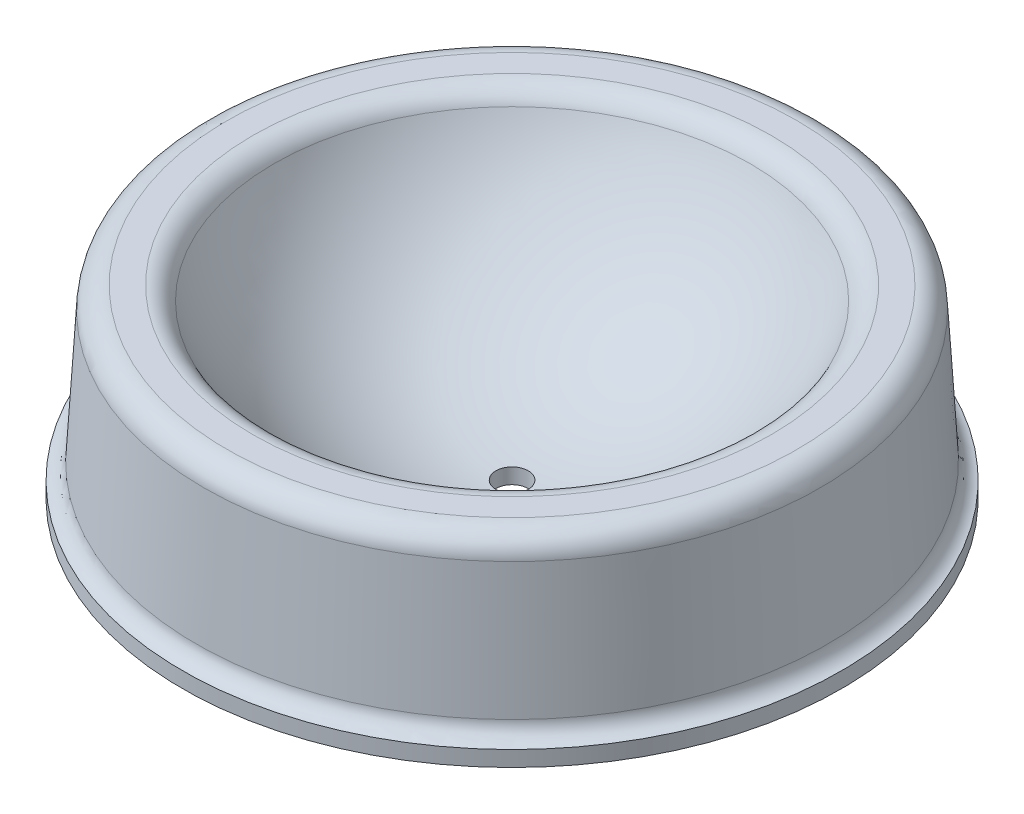
from build123d import *

# Parameters (mm, degrees)
HOLE_IN_BASE_REACH      = 34.556
HOLE_IN_BASE_END_RADIUS = 16.875
SKETCH2_R               = 1.05


with BuildPart() as part:
    # Sketch1 → MAIN BODY (revolve)
    with BuildSketch(Plane.XY, mode=Mode.PRIVATE) as main_body_sk:
        with BuildLine():
            Line((19.5, 2), (19, 10.52926063))
            ThreePointArc((19, 10.52926063), (18.843909163, 10.863751505), (18.500856919, 11))
            Line((18.500856919, 11), (16.83003268, 11))
            ThreePointArc((16.83003268, 11), (16.556482077, 10.918533234), (16.372072607, 10.700680272))
            ThreePointArc((16.372072607, 10.700680272), (9.779434029, 2.912436882), (0, 0))
            Line((0, 0), (0, 1))
            ThreePointArc((0, 1), (9.232332825, 3.74950335), (15.456152461, 11.102040816))
            ThreePointArc((15.456152461, 11.102040816), (16.009380873, 11.755599702), (16.83003268, 12))
            Line((16.83003268, 12), (18.500856919, 12))
            ThreePointArc((18.500856919, 12), (19.530013652, 11.591254516), (19.998286162, 10.58778189))
            Line((19.998286162, 10.58778189), (20.498286162, 2.05852126))
            ThreePointArc((20.498286162, 2.05852126), (20.772043039, 1.382491449), (21.4, 1.011507368))
            Line((21.4, 1.011507368), (21.4, 0))
            ThreePointArc((21.4, 0), (20.084286851, 0.652572509), (19.5, 2))
        make_face()
    revolve(main_body_sk.sketch.rotate(Axis((0, 0, 0), (0, 1, 0)), 90), axis=Axis((0, 0, 0), (0, 1, 0)))

    # HOLE IN BASE: up to this sphere (the profile starts outside it)
    hole_in_base_end = Location((0, 17.875, 0)) * Sphere(HOLE_IN_BASE_END_RADIUS, mode=Mode.PRIVATE)
    # Sketch2 → HOLE IN BASE (cut, up to the surface)
    with BuildSketch(Plane(origin=(0, 0, 0), x_dir=(1, 0, 0), z_dir=(0, 1, 0)), mode=Mode.PRIVATE) as hole_in_base_sk1:
        Circle(SKETCH2_R)
    hole_in_base_tool1 = extrude(hole_in_base_sk1.sketch, amount=HOLE_IN_BASE_REACH, mode=Mode.PRIVATE) - hole_in_base_end
    add(hole_in_base_tool1.solids().sort_by_distance((0, 0, 0))[0], mode=Mode.SUBTRACT)


solid = part.part
